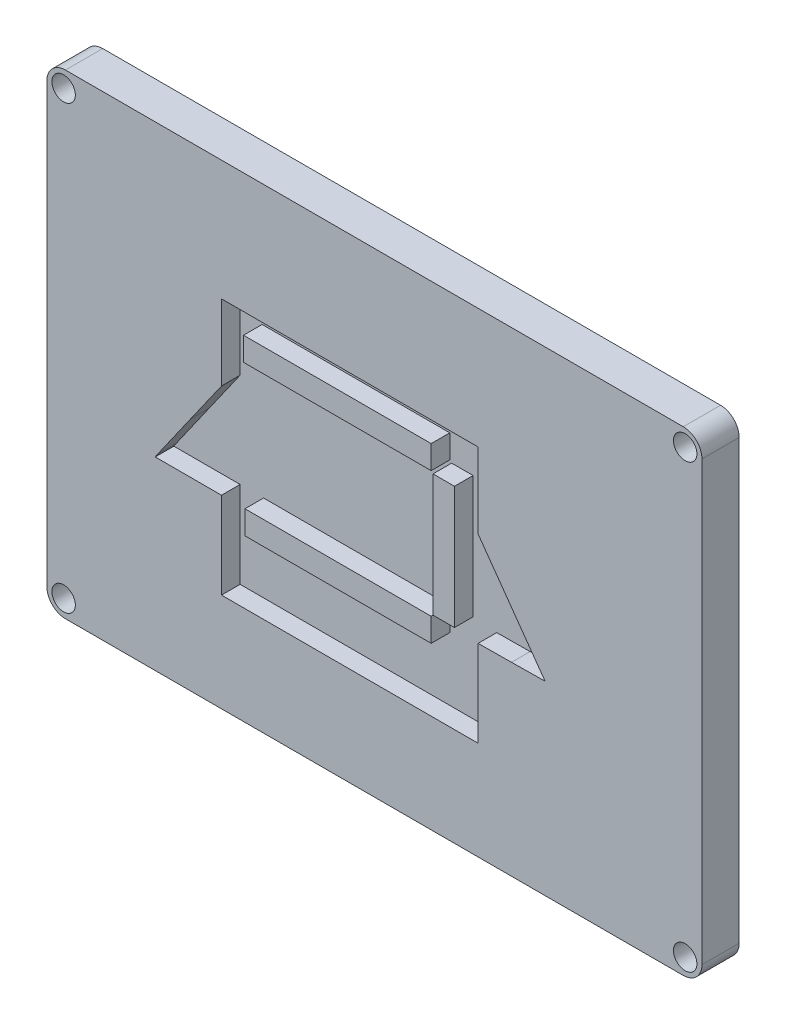
from build123d import *

# Parameters (mm, degrees)
SKETCH1_W            = 89.3572
SKETCH1_H            = 64.8208
SKETCH1_R            = 1.6
BOSS_EXTRUDE1_DEPTH  = 2.54
SKETCH2_W            = 89.3572
SKETCH2_H            = 64.8208
SKETCH2_R            = 1.6
SKETCH2_W_2          = 25.6
SKETCH2_H_2          = 3.2
SKETCH2_W_3          = 25.4
BOSS_EXTRUDE11_DEPTH = 2.54
SKETCH3_W            = 2.92236531
SKETCH3_H            = 16.692
BOSS_EXTRUDE13_DEPTH = 2.54
FILLET1_R            = 2.54


with BuildPart() as part:
    # Sketch1 → Boss-Extrude1 (new body)
    with BuildSketch(Plane.XY):
        Rectangle(SKETCH1_W, SKETCH1_H)
        with Locations((-42.3926, 30.1244)):
            Circle(SKETCH1_R, mode=Mode.SUBTRACT)
        with Locations((-42.3926, -30.1244)):
            Circle(SKETCH1_R, mode=Mode.SUBTRACT)
        with Locations((42.3926, -30.1244)):
            Circle(SKETCH1_R, mode=Mode.SUBTRACT)
        with Locations((42.3926, 30.1244)):
            Circle(SKETCH1_R, mode=Mode.SUBTRACT)
    extrude(amount=BOSS_EXTRUDE1_DEPTH)

    # Sketch2 → Boss-Extrude11 (add)
    # profile 1 of 3: a face of its own
    with BuildSketch(Plane.XY.offset(2.54)):
        Rectangle(SKETCH2_W, SKETCH2_H)
        with Locations((-42.3926, -30.1244)):
            Circle(SKETCH2_R, mode=Mode.SUBTRACT)
        with BuildLine():
            Line((-20.85424435, -7.173869479), (-29.894283412, -7.173869479))
            Line((-29.894283412, -7.173869479), (-29.594283412, -6.713908542))
            add(Edge.make_bspline(
                [(-25.074263881, -0.273869479), (-27.394283412, -3.573869479), (-29.434224819, -6.473869479), (-29.594283412, -6.713908542)],
                knots=[18, 18, 18, 18, 19, 19, 19, 19], degree=3))
            Line((-25.074263881, -0.273869479), (-20.85424435, 5.726130521))
            Line((-20.85424435, 5.726130521), (-20.85424435, 16.026130521))
            Line((-20.85424435, 16.026130521), (14.14575565, 16.026130521))
            Line((14.14575565, 16.026130521), (14.14575565, 10.886091458))
            Line((14.14575565, 10.886091458), (14.165677525, 5.726130521))
            Line((14.165677525, 5.726130521), (18.725833775, -0.673869479))
            Line((18.725833775, -0.673869479), (23.285794713, -7.073869479))
            Line((23.285794713, -7.073869479), (18.705716588, -7.133830417))
            Line((18.705716588, -7.133830417), (14.14575565, -7.173869479))
            Line((14.14575565, -7.173869479), (14.14575565, -18.973869479))
            Line((14.14575565, -18.973869479), (-20.85424435, -18.973869479))
            Line((-20.85424435, -18.973869479), (-20.85424435, -7.173869479))
        make_face(mode=Mode.SUBTRACT)
        with Locations((42.3926, -30.1244)):
            Circle(SKETCH2_R, mode=Mode.SUBTRACT)
        with Locations((-42.3926, 30.1244)):
            Circle(SKETCH2_R, mode=Mode.SUBTRACT)
        with Locations((42.3926, 30.1244)):
            Circle(SKETCH2_R, mode=Mode.SUBTRACT)
    # profile 2 of 3: a face of its own
    with BuildSketch(Plane.XY.offset(2.54)):
        with Locations((-5.05424435, 11.626130521)):
            Rectangle(SKETCH2_W_2, SKETCH2_H_2)
    # profile 3 of 3: a face of its own
    with BuildSketch(Plane.XY.offset(2.54)):
        with Locations((-4.95424435, -8.773869479)):
            Rectangle(SKETCH2_W_3, SKETCH2_H_2)
    extrude(amount=BOSS_EXTRUDE11_DEPTH)

    # Sketch3 → Boss-Extrude13 (add)
    with BuildSketch(Plane.XY.offset(2.54)):
        with Locations((9.460938305, 1.426130521)):
            Rectangle(SKETCH3_W, SKETCH3_H)
    extrude(amount=BOSS_EXTRUDE13_DEPTH)

    # Fillet1
    fillet1_edges = [part.edges().sort_by_distance(p)[0] for p in [
        (-44.6786, -32.4104, 2.54),
        (-44.6786, 32.4104, 2.54),
        (44.6786, 32.4104, 2.54),
        (44.6786, -32.4104, 2.54),
    ]]
    fillet(fillet1_edges, radius=FILLET1_R)


solid = part.part
